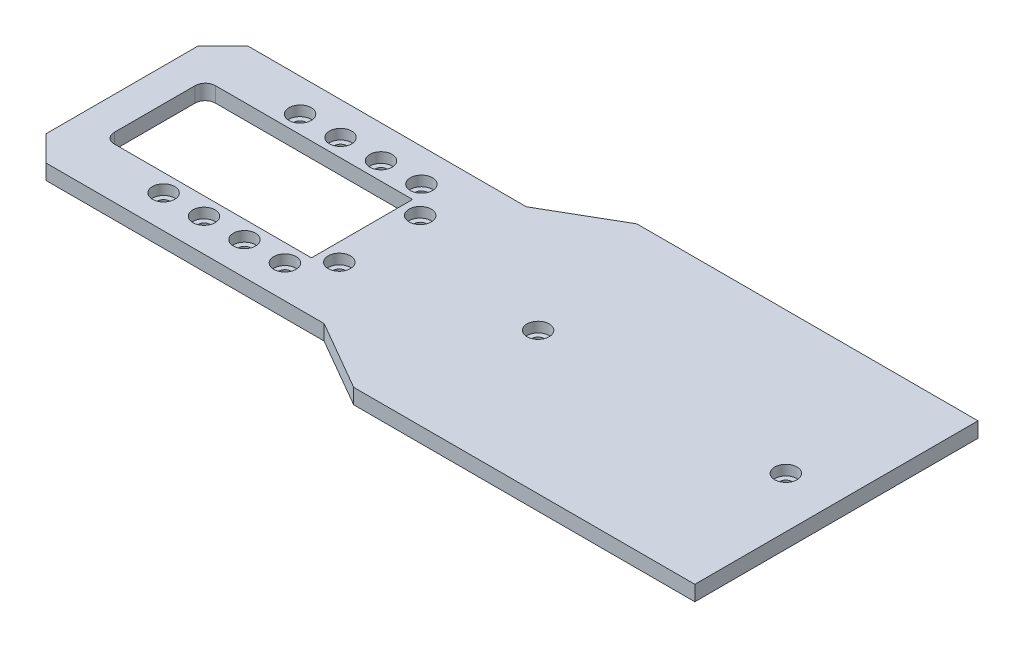
from build123d import *

# Parameters (mm, degrees)
EXTRUDE_1_DEPTH              = 3
CUT_EXTRUDE_1_REACH          = 217.134
HOLE_WIZARD_M2_2_D           = 2.4
HOLE_WIZARD_M2_2_CBORE_D     = 4.4
HOLE_WIZARD_M2_2_CBORE_DEPTH = 2
CUT_EXTRUDE_2_REACH          = 217.134
HOLE_WIZARD_M2_3_D           = 2.4
HOLE_WIZARD_M2_3_CBORE_D     = 4.4
HOLE_WIZARD_M2_3_CBORE_DEPTH = 2
MIRROR_7_COPY_1_REACH        = 217.134
MIRROR_7_COPY_2_D            = 2.4
MIRROR_7_COPY_2_CBORE_D      = 4.4
MIRROR_7_COPY_2_CBORE_DEPTH  = 2
CUT_EXTRUDE_3_REACH          = 217.134
SKETCH_18_W                  = 20
SKETCH_18_H                  = 10
HOLE_WIZARD_M2_4_D           = 2.4
HOLE_WIZARD_M2_4_CBORE_D     = 4.4
HOLE_WIZARD_M2_4_CBORE_DEPTH = 2
HOLE_WIZARD_M2_5_D           = 2.4
HOLE_WIZARD_M2_5_CBORE_D     = 4.4
HOLE_WIZARD_M2_5_CBORE_DEPTH = 2
HOLE_WIZARD_M2_6_D           = 2.4
HOLE_WIZARD_M2_6_CBORE_D     = 4.4
HOLE_WIZARD_M2_6_CBORE_DEPTH = 2
SKETCH_24_W                  = 20
SKETCH_24_H                  = 56
CUT_EXTRUDE_4_DEPTH          = 10
HOLE_WIZARD_M2_7_D           = 2.4
HOLE_WIZARD_M2_7_CBORE_D     = 4.4
HOLE_WIZARD_M2_7_CBORE_DEPTH = 2
SKETCH_26_OUTSIDE_W          = 390.69
SKETCH_26_OUTSIDE_H          = 393.83
SKETCH_26_OUTSIDE_W_2        = 141.320508076
SKETCH_26_OUTSIDE_H_2        = 56
CUT_EXTRUDE_5_DEPTH          = 10


with BuildPart() as part:
    # 草图1 → 凸台-拉伸1 (new body)
    with BuildSketch(Plane(origin=(0, 0, 0), x_dir=(1, 0, 0), z_dir=(0, 1, 0))):
        Polygon((-45.715728753, 114), (45.715728753, 114), (84.606601718, 152.890872965), (91.67766953, 152.890872965), (112.890872965, 131.67766953), (112.890872965, 124.606601718), (74, 85.715728753), (74, 30), (91.320508076, 20), (146.320508076, 20), (151.320508076, 15), (151.320508076, -15), (146.320508076, -20), (91.320508076, -20), (74, -30), (74, -85.715728753), (112.890872965, -124.606601718), (112.890872965, -131.67766953), (91.67766953, -152.890872965), (84.606601718, -152.890872965), (45.715728753, -114), (-45.715728753, -114), (-84.606601718, -152.890872965), (-91.67766953, -152.890872965), (-112.890872965, -131.67766953), (-112.890872965, -124.606601718), (-74, -85.715728753), (-74, -30), (-91.320508076, -20), (-146.320508076, -20), (-151.320508076, -15), (-151.320508076, 15), (-146.320508076, 20), (-91.320508076, 20), (-74, 30), (-74, 85.715728753), (-112.890872965, 124.606601718), (-112.890872965, 131.67766953), (-91.67766953, 152.890872965), (-84.606601718, 152.890872965), align=None)
    extrude(amount=EXTRUDE_1_DEPTH)

    # 草图2 → 切除-拉伸1 (cut, up to next)
    with BuildSketch(Plane(origin=(0, 3, 0), x_dir=(1, 0, 0), z_dir=(0, 1, 0)), mode=Mode.PRIVATE) as cut_extrude_1_sk1:
        with BuildLine():
            Line((103.820508076, -10), (103.820508076, 10))
            Line((103.820508076, 10), (142.820508076, 10))
            ThreePointArc((142.820508076, 10), (144.234721638, 9.414213562), (144.820508076, 8))
            Line((144.820508076, 8), (144.820508076, -8))
            ThreePointArc((144.820508076, -8), (144.234721638, -9.414213562), (142.820508076, -10))
            Line((142.820508076, -10), (103.820508076, -10))
        make_face()
    cut_extrude_1_tool1 = extrude(cut_extrude_1_sk1.sketch, amount=-CUT_EXTRUDE_1_REACH, mode=Mode.PRIVATE) & part.part
    cut_extrude_1 = cut_extrude_1_tool1.solids().sort_by_distance((124.278435, 3, 0))[0]
    add(cut_extrude_1, mode=Mode.SUBTRACT)

    # M2 凹头盖螺钉的柱形沉头孔2 (through all)
    with Locations(Plane(origin=(100.320508076, 3, -8), x_dir=(0, 0, 1), z_dir=(0, 1, 0))):
        with Locations((0, 0), (-5.5, 5.25), (-5.5, 13.25), (-5.5, 21.25), (-5.5, 29.25), (16, 0), (21.5, 5.25), (21.5, 13.25), (21.5, 21.25), (21.5, 29.25)):
            hole_wizard_m2_2 = CounterBoreHole(HOLE_WIZARD_M2_2_D / 2, HOLE_WIZARD_M2_2_CBORE_D / 2, HOLE_WIZARD_M2_2_CBORE_DEPTH)

    # 草图10 → 切除-拉伸2 (cut, up to next)
    with BuildSketch(Plane(origin=(0, 3, 0), x_dir=(1, 0, 0), z_dir=(0, 1, 0)), mode=Mode.PRIVATE) as cut_extrude_2_sk1:
        with BuildLine():
            Line((75.767766953, 101.625631329), (61.625631329, 115.767766953))
            Line((61.625631329, 115.767766953), (79.916185958, 134.058321582))
            Line((79.916185958, 134.058321582), (89.202795796, 143.344931419))
            ThreePointArc((89.202795796, 143.344931419), (90.617009358, 143.930717857), (92.03122292, 143.344931419))
            Line((92.03122292, 143.344931419), (97.68807717, 137.68807717))
            Line((97.68807717, 137.68807717), (103.344931419, 132.03122292))
            ThreePointArc((103.344931419, 132.03122292), (103.930717857, 130.617009358), (103.344931419, 129.202795796))
            Line((103.344931419, 129.202795796), (94.058321582, 119.916185958))
            Line((94.058321582, 119.916185958), (75.767766953, 101.625631329))
        make_face()
    cut_extrude_2_tool1 = extrude(cut_extrude_2_sk1.sketch, amount=-CUT_EXTRUDE_2_REACH, mode=Mode.PRIVATE) & part.part
    cut_extrude_2 = cut_extrude_2_tool1.solids().sort_by_distance((83.162638, 3, -123.162638))[0]
    add(cut_extrude_2, mode=Mode.SUBTRACT)

    # M2 凹头盖螺钉的柱形沉头孔3 (through all)
    with Locations(Plane(origin=(60.388194462, 3, -119.480077554), x_dir=(0, 0, 1), z_dir=(0, 1, 0))):
        with Locations((0, 0), (-5.65685425, 5.65685425), (-11.313708499, 11.313708499), (-16.970562749, 16.970562749), (7.601397898, 0.176776695), (18.915106397, 11.490485194), (19.091883092, 19.091883092), (13.435028842, 24.748737342), (7.778174593, 30.405591591), (2.121320343, 36.062445841)):
            hole_wizard_m2_3 = CounterBoreHole(HOLE_WIZARD_M2_3_D / 2, HOLE_WIZARD_M2_3_CBORE_D / 2, HOLE_WIZARD_M2_3_CBORE_DEPTH)

    # 镜向5: 切除-拉伸1, M2 凹头盖螺钉的柱形沉头孔2 across plane
    add(cut_extrude_1.mirror(Plane(origin=(0, 0, 0), x_dir=(0, 0, 1), z_dir=(1, 0, 0))), mode=Mode.SUBTRACT)
    add(hole_wizard_m2_2.mirror(Plane(origin=(0, 0, 0), x_dir=(0, 0, 1), z_dir=(1, 0, 0))), mode=Mode.SUBTRACT)

    # 镜向6: 切除-拉伸2, M2 凹头盖螺钉的柱形沉头孔3 across plane
    add(cut_extrude_2.mirror(Plane(origin=(0, 0, 0), x_dir=(0, 0, 1), z_dir=(1, 0, 0))), mode=Mode.SUBTRACT)
    add(hole_wizard_m2_3.mirror(Plane(origin=(0, 0, 0), x_dir=(0, 0, 1), z_dir=(1, 0, 0))), mode=Mode.SUBTRACT)

    # 镜向7: 切除-拉伸2, M2 凹头盖螺钉的柱形沉头孔3 across plane
    add(cut_extrude_2.mirror(Plane.XY), mode=Mode.SUBTRACT)
    add(hole_wizard_m2_3.mirror(Plane.XY), mode=Mode.SUBTRACT)

    # 镜向7 copy 1 sketch → 镜向7 copy 1 (cut, up to next)
    with BuildSketch(Plane(origin=(0, 3, 0), x_dir=(-1, 0, 0), z_dir=(0, 1, 0)), mode=Mode.PRIVATE) as mirror_7_copy_1_sk1:
        with BuildLine():
            Line((75.767766953, 101.625631329), (61.625631329, 115.767766953))
            Line((61.625631329, 115.767766953), (79.916185958, 134.058321582))
            Line((79.916185958, 134.058321582), (89.202795796, 143.344931419))
            ThreePointArc((89.202795796, 143.344931419), (90.617009358, 143.930717857), (92.03122292, 143.344931419))
            Line((92.03122292, 143.344931419), (97.68807717, 137.68807717))
            Line((97.68807717, 137.68807717), (103.344931419, 132.03122292))
            ThreePointArc((103.344931419, 132.03122292), (103.930717857, 130.617009358), (103.344931419, 129.202795796))
            Line((103.344931419, 129.202795796), (94.058321582, 119.916185958))
            Line((94.058321582, 119.916185958), (75.767766953, 101.625631329))
        make_face()
    mirror_7_copy_1_tool1 = extrude(mirror_7_copy_1_sk1.sketch, amount=-MIRROR_7_COPY_1_REACH, mode=Mode.PRIVATE) & part.part
    add(mirror_7_copy_1_tool1.solids().sort_by_distance((-83.162638, 3, 123.162638))[0], mode=Mode.SUBTRACT)

    # 镜向7 copy 2 (through all)
    with Locations(Plane(origin=(-60.388194462, 3, 119.480077554), x_dir=(0, 0, -1), z_dir=(0, 1, 0))):
        with Locations((0, 0), (-5.65685425, 5.65685425), (-11.313708499, 11.313708499), (-16.970562749, 16.970562749), (7.601397898, 0.176776695), (18.915106397, 11.490485194), (19.091883092, 19.091883092), (13.435028842, 24.748737342), (7.778174593, 30.405591591), (2.121320343, 36.062445841)):
            CounterBoreHole(MIRROR_7_COPY_2_D / 2, MIRROR_7_COPY_2_CBORE_D / 2, MIRROR_7_COPY_2_CBORE_DEPTH)

    # 草图18 → 切除-拉伸3 (cut, up to next)
    with BuildSketch(Plane(origin=(0, 3, 0), x_dir=(1, 0, 0), z_dir=(0, 1, 0)), mode=Mode.PRIVATE) as cut_extrude_3_sk1:
        Polygon((-60, -28), (-15, -28), (-15, -63), (-60, -83), align=None)
    cut_extrude_3_tool1 = extrude(cut_extrude_3_sk1.sketch, amount=-CUT_EXTRUDE_3_REACH, mode=Mode.PRIVATE) & part.part
    # 草图18 → 切除-拉伸3 (cut, up to next)
    with BuildSketch(Plane(origin=(0, 3, 0), x_dir=(1, 0, 0), z_dir=(0, 1, 0)), mode=Mode.PRIVATE) as cut_extrude_3_sk2:
        with Locations((20, -99)):
            Rectangle(SKETCH_18_W, SKETCH_18_H)
    cut_extrude_3_tool2 = extrude(cut_extrude_3_sk2.sketch, amount=-CUT_EXTRUDE_3_REACH, mode=Mode.PRIVATE) & part.part
    # 草图18 → 切除-拉伸3 (cut, up to next)
    with BuildSketch(Plane(origin=(0, 3, 0), x_dir=(1, 0, 0), z_dir=(0, 1, 0)), mode=Mode.PRIVATE) as cut_extrude_3_sk3:
        with Locations((-20, -99)):
            Rectangle(SKETCH_18_W, SKETCH_18_H)
    cut_extrude_3_tool3 = extrude(cut_extrude_3_sk3.sketch, amount=-CUT_EXTRUDE_3_REACH, mode=Mode.PRIVATE) & part.part
    # 草图18 → 切除-拉伸3 (cut, up to next)
    with BuildSketch(Plane(origin=(0, 3, 0), x_dir=(1, 0, 0), z_dir=(0, 1, 0)), mode=Mode.PRIVATE) as cut_extrude_3_sk4:
        Polygon((15, -63), (60, -83), (60, -28), (15, -28), align=None)
    cut_extrude_3_tool4 = extrude(cut_extrude_3_sk4.sketch, amount=-CUT_EXTRUDE_3_REACH, mode=Mode.PRIVATE) & part.part
    # 草图18 → 切除-拉伸3 (cut, up to next)
    with BuildSketch(Plane(origin=(0, 3, 0), x_dir=(1, 0, 0), z_dir=(0, 1, 0)), mode=Mode.PRIVATE) as cut_extrude_3_sk5:
        with Locations((-20, 99)):
            Rectangle(SKETCH_18_W, SKETCH_18_H)
    cut_extrude_3_tool5 = extrude(cut_extrude_3_sk5.sketch, amount=-CUT_EXTRUDE_3_REACH, mode=Mode.PRIVATE) & part.part
    # 草图18 → 切除-拉伸3 (cut, up to next)
    with BuildSketch(Plane(origin=(0, 3, 0), x_dir=(1, 0, 0), z_dir=(0, 1, 0)), mode=Mode.PRIVATE) as cut_extrude_3_sk6:
        with Locations((20, 99)):
            Rectangle(SKETCH_18_W, SKETCH_18_H)
    cut_extrude_3_tool6 = extrude(cut_extrude_3_sk6.sketch, amount=-CUT_EXTRUDE_3_REACH, mode=Mode.PRIVATE) & part.part
    # 草图18 → 切除-拉伸3 (cut, up to next)
    with BuildSketch(Plane(origin=(0, 3, 0), x_dir=(1, 0, 0), z_dir=(0, 1, 0)), mode=Mode.PRIVATE) as cut_extrude_3_sk7:
        Polygon((15, 63), (60, 83), (60, 28), (15, 28), align=None)
    cut_extrude_3_tool7 = extrude(cut_extrude_3_sk7.sketch, amount=-CUT_EXTRUDE_3_REACH, mode=Mode.PRIVATE) & part.part
    # 草图18 → 切除-拉伸3 (cut, up to next)
    with BuildSketch(Plane(origin=(0, 3, 0), x_dir=(1, 0, 0), z_dir=(0, 1, 0)), mode=Mode.PRIVATE) as cut_extrude_3_sk8:
        Polygon((-15, 28), (-15, 63), (-60, 83), (-60, 28), align=None)
    cut_extrude_3_tool8 = extrude(cut_extrude_3_sk8.sketch, amount=-CUT_EXTRUDE_3_REACH, mode=Mode.PRIVATE) & part.part
    add(cut_extrude_3_tool1.solids().sort_by_distance((-39.166667, 3, 50.87037))[0], mode=Mode.SUBTRACT)
    add(cut_extrude_3_tool2.solids().sort_by_distance((20, 3, 99))[0], mode=Mode.SUBTRACT)
    add(cut_extrude_3_tool3.solids().sort_by_distance((-20, 3, 99))[0], mode=Mode.SUBTRACT)
    add(cut_extrude_3_tool4.solids().sort_by_distance((39.166667, 3, 50.87037))[0], mode=Mode.SUBTRACT)
    add(cut_extrude_3_tool5.solids().sort_by_distance((-20, 3, -99))[0], mode=Mode.SUBTRACT)
    add(cut_extrude_3_tool6.solids().sort_by_distance((20, 3, -99))[0], mode=Mode.SUBTRACT)
    add(cut_extrude_3_tool7.solids().sort_by_distance((39.166667, 3, -50.87037))[0], mode=Mode.SUBTRACT)
    add(cut_extrude_3_tool8.solids().sort_by_distance((-39.166667, 3, -50.87037))[0], mode=Mode.SUBTRACT)

    # M2 凹头盖螺钉的柱形沉头孔4 (through all)
    with Locations(Plane(origin=(-20, 3, 109), x_dir=(0, 0, 1), z_dir=(0, 1, 0))):
        with Locations((0, 0), (0, 40), (-218, 0), (-218, 40)):
            CounterBoreHole(HOLE_WIZARD_M2_4_D / 2, HOLE_WIZARD_M2_4_CBORE_D / 2, HOLE_WIZARD_M2_4_CBORE_DEPTH)

    # M2 凹头盖螺钉的柱形沉头孔5 (through all)
    with Locations(Plane(origin=(-69, 3, -40), x_dir=(0, 0, 1), z_dir=(0, 1, 0))):
        with Locations((0, 0), (0, 138)):
            hole_wizard_m2_5 = CounterBoreHole(HOLE_WIZARD_M2_5_D / 2, HOLE_WIZARD_M2_5_CBORE_D / 2, HOLE_WIZARD_M2_5_CBORE_DEPTH)

    # 镜向8: M2 凹头盖螺钉的柱形沉头孔5 across plane
    add(hole_wizard_m2_5.mirror(Plane.XY), mode=Mode.SUBTRACT)

    # M2 凹头盖螺钉的柱形沉头孔6 (through all)
    with Locations(Plane(origin=(-69, 3, 0), x_dir=(0, 0, 1), z_dir=(0, 1, 0))):
        with Locations((0, 0), (0, 138)):
            CounterBoreHole(HOLE_WIZARD_M2_6_D / 2, HOLE_WIZARD_M2_6_CBORE_D / 2, HOLE_WIZARD_M2_6_CBORE_DEPTH)

    # 草图24 → 切除-拉伸4 (cut)
    with BuildSketch(Plane(origin=(0, 3, 0), x_dir=(1, 0, 0), z_dir=(0, 1, 0))):
        Rectangle(SKETCH_24_W, SKETCH_24_H)
    extrude(amount=-CUT_EXTRUDE_4_DEPTH, mode=Mode.SUBTRACT)

    # M2 凹头盖螺钉的柱形沉头孔7 (through all)
    with Locations(Plane(origin=(-20, 3, 0), x_dir=(0, 0, 1), z_dir=(0, 1, 0))):
        with Locations((0, 0), (0, 40)):
            CounterBoreHole(HOLE_WIZARD_M2_7_D / 2, HOLE_WIZARD_M2_7_CBORE_D / 2, HOLE_WIZARD_M2_7_CBORE_DEPTH)

    # 草图26 outside → 切除-拉伸5 (cut)
    with BuildSketch(Plane(origin=(0, 3, 0), x_dir=(1, 0, 0), z_dir=(0, 1, 0))):
        Rectangle(SKETCH_26_OUTSIDE_W, SKETCH_26_OUTSIDE_H)
        with Locations((-80.660254038, 0)):
            Rectangle(SKETCH_26_OUTSIDE_W_2, SKETCH_26_OUTSIDE_H_2, mode=Mode.SUBTRACT)
    extrude(amount=-CUT_EXTRUDE_5_DEPTH, mode=Mode.SUBTRACT)


solid = part.part
